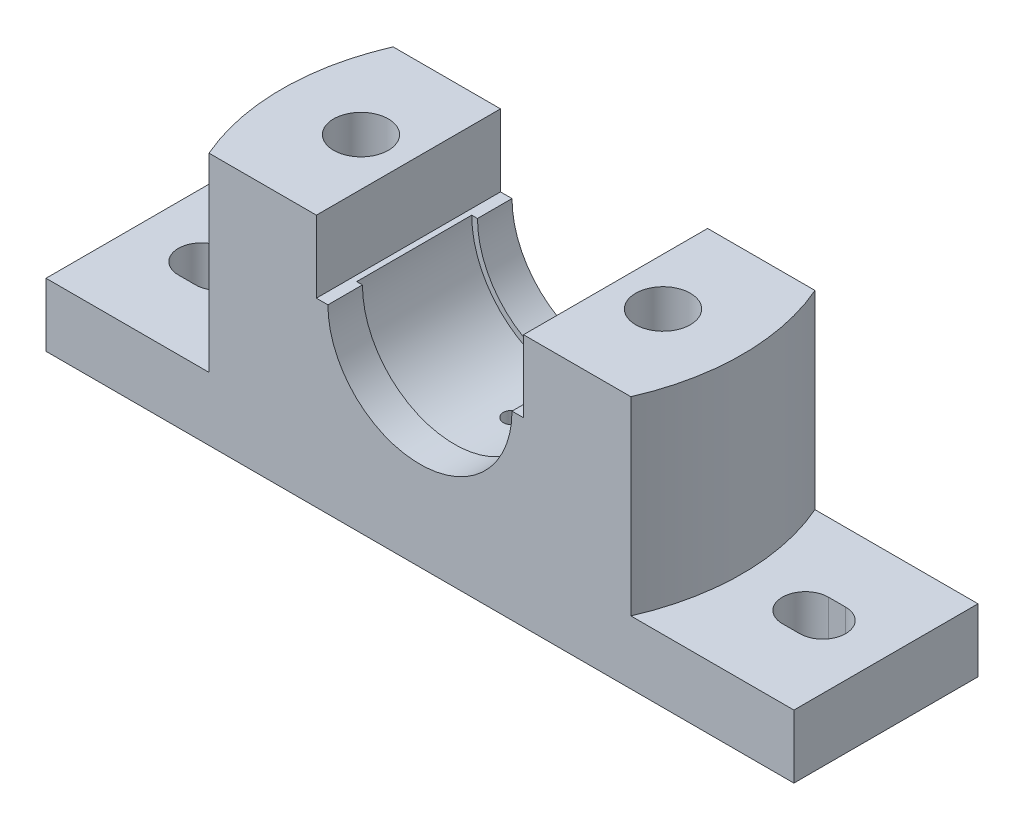
from build123d import *

# Parameters (mm, degrees)
SKETCH1_W               = 260
SKETCH1_H               = 64
BOSS_EXTRUDE1_DEPTH     = 22
SKETCH3_R               = 9.5
BOSS_EXTRUDE2_DEPTH     = 66
CUT_EXTRUDE2_DEPTH      = 75
CUT_EXTRUDE3_DEPTH      = 20
CUT_EXTRUDE5_DEPTH      = 40
CUT_EXTRUDE5_DEPTH_BACK = 6
SKETCH7_R               = 3
SKETCH8_W               = 67.321211119
SKETCH8_H               = 40
CUT_EXTRUDE6_DEPTH      = 2
SKETCH9_R               = 9.5
CUT_EXTRUDE7_DEPTH      = 45


with BuildPart() as part:
    # Sketch1 → Boss-Extrude1 (new body)
    with BuildSketch(Plane(origin=(0, 0, 0), x_dir=(1, 0, 0), z_dir=(0, 1, 0))):
        Rectangle(SKETCH1_W, SKETCH1_H)
        with BuildLine():
            Line((-102, -8), (-108, -8))
            ThreePointArc((-108, -8), (-116, 0), (-108, 8))
            Line((-108, 8), (-102, 8))
            ThreePointArc((-102, 8), (-94, 0), (-102, -8))
        make_face(mode=Mode.SUBTRACT)
        with BuildLine():
            Line((102, -8), (108, -8))
            ThreePointArc((108, -8), (116, 0), (108, 8))
            Line((108, 8), (102, 8))
            ThreePointArc((102, 8), (94, 0), (102, -8))
        make_face(mode=Mode.SUBTRACT)
    extrude(amount=BOSS_EXTRUDE1_DEPTH)

    # Sketch3 → Boss-Extrude2 (add)
    with BuildSketch(Plane(origin=(0, 88, 0), x_dir=(-1, 0, 0), z_dir=(0, -1, 0))):
        with BuildLine():
            Line((73.321211119, -32), (-73.321211119, -32))
            ThreePointArc((-73.321211119, -32), (-80, 0), (-73.321211119, 32))
            Line((-73.321211119, 32), (73.321211119, 32))
            ThreePointArc((73.321211119, 32), (80, 0), (73.321211119, -32))
        make_face()
        with Locations(Location((-52.5, 0, 0), (0, 0, 270))):
            Circle(SKETCH3_R, mode=Mode.SUBTRACT)
        with Locations(Location((52.5, 0, 0), (0, 0, 270))):
            Circle(SKETCH3_R, mode=Mode.SUBTRACT)
    extrude(amount=BOSS_EXTRUDE2_DEPTH)

    # Sketch5 → Cut-Extrude2 (cut)
    with BuildSketch(Plane.XY.offset(32)):
        with BuildLine():
            Line((-36, 63), (-32, 63))
            ThreePointArc((-32, 63), (-22.627416998, 40.372583002), (0, 31))
            Line((0, 31), (0, 88))
            Line((0, 88), (-36, 88))
            Line((-36, 88), (-36, 63))
        make_face()
    cut_extrude2 = extrude(amount=-CUT_EXTRUDE2_DEPTH, mode=Mode.SUBTRACT)

    # Sketch6 → Cut-Extrude3 (cut, symmetric)
    with BuildSketch(Plane.XY):
        with BuildLine():
            Line((-34, 63), (0, 63))
            Line((0, 63), (0, 29))
            ThreePointArc((0, 29), (-24.04163056, 38.95836944), (-34, 63))
        make_face()
    cut_extrude3 = extrude(amount=CUT_EXTRUDE3_DEPTH, both=True, mode=Mode.SUBTRACT)

    # Mirror1: Cut-Extrude2, Cut-Extrude3 across plane
    add(cut_extrude2.mirror(Plane(origin=(0, 0, 0), x_dir=(0, 0, 1), z_dir=(1, 0, 0))), mode=Mode.SUBTRACT)
    add(cut_extrude3.mirror(Plane(origin=(0, 0, 0), x_dir=(0, 0, 1), z_dir=(1, 0, 0))), mode=Mode.SUBTRACT)

    # Sketch7 → Cut-Extrude5 (cut, two sides: drawn at the far end of the back side and taken through both)
    with BuildSketch(Plane(origin=(0, 29, 0), x_dir=(1, 0, 0), z_dir=(0, 1, 0)).offset(-CUT_EXTRUDE5_DEPTH_BACK)):
        with Locations(Location((0, 0, 0), (0, 0, 90))):
            Circle(SKETCH7_R)
    extrude(amount=CUT_EXTRUDE5_DEPTH + CUT_EXTRUDE5_DEPTH_BACK, mode=Mode.SUBTRACT)

    # Sketch8 → Cut-Extrude6 (cut)
    with BuildSketch(Plane.XZ):
        with Locations((39.66060556, 0)):
            Rectangle(SKETCH8_W, SKETCH8_H)
    cut_extrude6 = extrude(amount=-CUT_EXTRUDE6_DEPTH, mode=Mode.SUBTRACT)

    # Mirror2: Cut-Extrude6 across plane
    add(cut_extrude6.mirror(Plane(origin=(0, 0, 0), x_dir=(0, 0, 1), z_dir=(1, 0, 0))), mode=Mode.SUBTRACT)

    # Sketch9 → Cut-Extrude7 (cut)
    with BuildSketch(Plane(origin=(0, 22, 0), x_dir=(1, 0, 0), z_dir=(0, 1, 0))):
        with Locations(Location((-52.5, 0, 0), (0, 0, 270))):
            Circle(SKETCH9_R)
        with Locations(Location((52.5, 0, 0), (0, 0, 270))):
            Circle(SKETCH9_R)
    extrude(amount=-CUT_EXTRUDE7_DEPTH, mode=Mode.SUBTRACT)


solid = part.part
